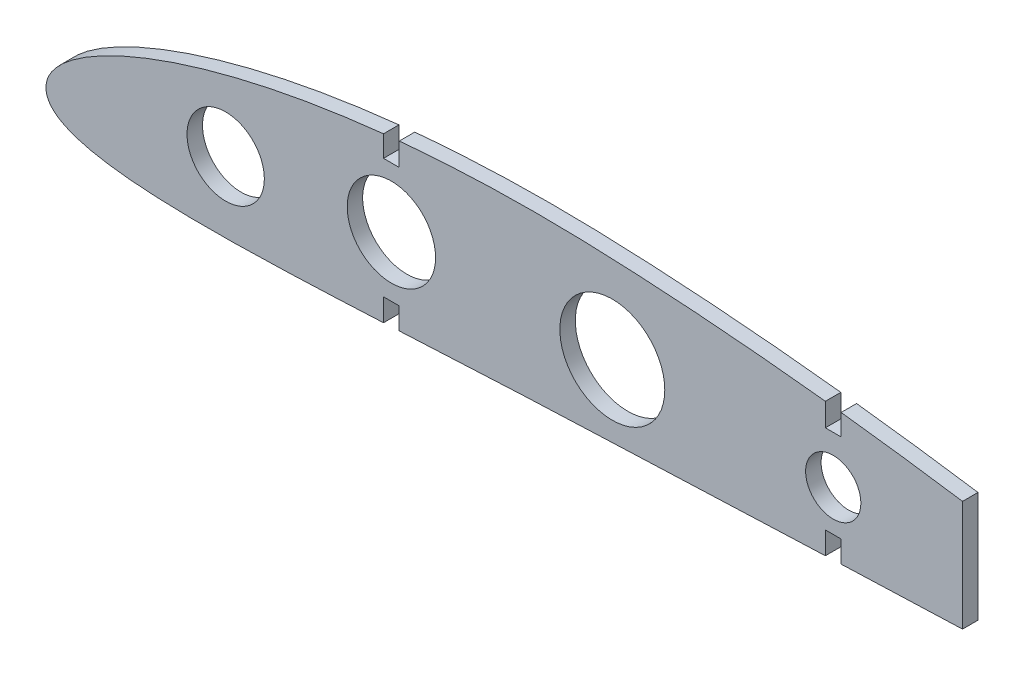
from build123d import *

# Parameters (mm, degrees)
SKETCH_1_R      = 7
SKETCH_1_R_2    = 8
SKETCH_1_R_3    = 9.5
SKETCH_1_R_4    = 5
EXTRUDE_1_DEPTH = 1.4


with BuildPart() as part:
    # Эскиз1 → Бобышка-Вытянуть1 (new, symmetric)
    with BuildSketch(Plane.XY):
        with BuildLine():
            Line((63.957619318, 19.450139662), (61.107619318, 19.450139662))
            Line((61.107619318, 19.450139662), (61.107619318, 23.303137173))
            add(Edge.make_bspline(
                [(61.107619318, 23.303137173), (59.917945614, 23.176751945), (56.739740439, 22.81448979), (51.605762688, 22.119065522), (45.744400311, 21.156564432), (39.995857594, 20.03537139), (34.397919842, 18.756316235), (29.010382103, 17.327615608), (23.925798408, 15.771864922), (19.27067884, 14.134269435), (15.179098391, 12.483335438), (11.74047579, 10.895610996), (8.959371869, 9.429577366), (6.76089118, 8.1086032), (5.033709748, 6.924638056), (3.671694933, 5.854229665), (2.592101123, 4.871305369), (1.738175668, 3.952595744), (1.06987083, 3.080946374), (0.57164541, 2.241622103), (0.215773899, 1.430785398), (0.102255581, 0.883241695), (0.047975, 0.621425001)],
                knots=[0.740090669, 0.740090669, 0.740090669, 0.740090669, 0.7539832, 0.77723469, 0.800246382, 0.822950709, 0.845237155, 0.866915896, 0.887662335, 0.906968281, 0.924203157, 0.938878975, 0.950931611, 0.960693484, 0.968646729, 0.975232933, 0.980794744, 0.985583761, 0.989781539, 0.993521313, 0.996902113, 1, 1, 1, 1], degree=3))
            add(Edge.make_bspline(
                [(0.047975, 0.621425001), (0.02271382, 0.373490086), (-0.027820789, -0.122499974), (0.077991212, -0.884434589), (0.34969565, -1.63883807), (0.814331135, -2.365068923), (1.46348078, -3.039275244), (2.290973016, -3.660999469), (3.30592875, -4.23577962), (4.535255619, -4.773674143), (6.029745688, -5.282192164), (7.868981215, -5.765316676), (10.168831391, -6.221716592), (13.075438188, -6.63961873), (16.728115362, -6.992956737), (21.189952096, -7.247345144), (26.399984415, -7.376638848), (32.197398564, -7.376256913), (38.397806759, -7.261436579), (44.857621768, -7.056641358), (51.486543096, -6.786453532), (56.920566709, -6.533358441), (60.139839208, -6.376114839), (61.107619318, -6.32836923)],
                knots=[0, 0, 0, 0, 0.002941446, 0.005884319, 0.00901613, 0.012364547, 0.016007934, 0.020036845, 0.024573728, 0.029783835, 0.03589701, 0.04324044, 0.052275965, 0.063634589, 0.077983176, 0.095698161, 0.116520086, 0.13966073, 0.16431217, 0.18991889, 0.216157201, 0.242837762, 0.254306514, 0.254306514, 0.254306514, 0.254306514], degree=3))
            Line((61.107619318, -6.32836923), (61.107619318, -2.257745247))
            Line((61.107619318, -2.257745247), (63.957619318, -2.257745247))
            Line((63.957619318, -2.257745247), (63.957619318, -6.186566126))
            add(Edge.make_bspline(
                [(63.957619318, -6.186566126), (64.317823095, -6.168514758), (66.969747676, -6.035316313), (71.910772709, -5.784005174), (78.771375576, -5.439680449), (85.610498609, -5.110951246), (92.432107589, -4.804953317), (99.25503119, -4.531981644), (106.097378404, -4.278274658), (112.96921168, -4.00308991), (119.864404254, -3.723176166), (126.773860473, -3.440067276), (133.855552455, -3.151608468), (138.633361552, -2.960411351), (141.107619318, -2.86287629)],
                knots=[0.265564796, 0.265564796, 0.265564796, 0.265564796, 0.269833583, 0.296993022, 0.324123272, 0.351139107, 0.378035509, 0.404946016, 0.431960837, 0.459078395, 0.4863474, 0.51364083, 0.540928595, 0.570237104, 0.570237104, 0.570237104, 0.570237104], degree=3))
            Line((141.107619318, -2.86287629), (141.107619318, 1.193130543))
            Line((141.107619318, 1.193130543), (143.957619318, 1.193130543))
            Line((143.957619318, 1.193130543), (143.957619318, -2.751209627))
            add(Edge.make_bspline(
                [(143.957619318, -2.751209627), (145.13020609, -2.705557458), (148.596084852, -2.571725453), (154.352602411, -2.355626415), (160.507662095, -2.135075484), (164.369425992, -2.00299999), (165.940456932, -1.950382964)],
                knots=[0.581490104, 0.581490104, 0.581490104, 0.581490104, 0.595379569, 0.622543445, 0.64967326, 0.668278692, 0.668278692, 0.668278692, 0.668278692], degree=3))
            Line((165.940456932, -1.950382964), (165.940456932, 7.49391084))
            Line((165.940456932, 7.49391084), (165.940456932, 18.08535451))
            add(Edge.make_bspline(
                [(165.940456932, 18.08535451), (165.930512987, 18.08685322), (163.740114226, 18.416932974), (159.368680729, 19.054501815), (152.821805128, 19.944885603), (147.683892721, 20.591912914), (144.728786809, 20.943344409), (143.957619318, 21.033629847)],
                knots=[0.332761263, 0.332761263, 0.332761263, 0.332761263, 0.332878042, 0.358484538, 0.384061186, 0.409602822, 0.418619192, 0.418619192, 0.418619192, 0.418619192], degree=3))
            Line((143.957619318, 21.033629847), (143.957619318, 17.19883932))
            Line((143.957619318, 17.19883932), (141.107619318, 17.19883932))
            Line((141.107619318, 17.19883932), (141.107619318, 21.360787161))
            add(Edge.make_bspline(
                [(141.107619318, 21.360787161), (140.647203073, 21.412583326), (138.008124909, 21.706530989), (133.19183673, 22.212004255), (126.658683026, 22.825721434), (120.136770918, 23.363973271), (113.62856714, 23.824677329), (107.152732037, 24.200242598), (100.741095693, 24.498399513), (94.411752715, 24.686649771), (88.155917993, 24.740095652), (81.949043055, 24.658849145), (75.780520591, 24.441013809), (69.785413798, 24.089605746), (65.850842722, 23.766532071), (63.957619318, 23.588464287)],
                knots=[0.429723551, 0.429723551, 0.429723551, 0.429723551, 0.435103874, 0.460559416, 0.485959195, 0.51130307, 0.536551515, 0.561723366, 0.586628867, 0.611085431, 0.6352512, 0.659272176, 0.683163753, 0.706922144, 0.729003809, 0.729003809, 0.729003809, 0.729003809], degree=3))
            Line((63.957619318, 23.588464287), (63.957619318, 19.450139662))
        make_face()
        with Locations((32.532619318, 5.448144701)):
            Circle(SKETCH_1_R, mode=Mode.SUBTRACT)
        with Locations((62.532619318, 8.596197208)):
            Circle(SKETCH_1_R_2, mode=Mode.SUBTRACT)
        with Locations((102.532619318, 8.596197208)):
            Circle(SKETCH_1_R_3, mode=Mode.SUBTRACT)
        with Locations((142.532619318, 8.596197208)):
            Circle(SKETCH_1_R_4, mode=Mode.SUBTRACT)
    extrude(amount=EXTRUDE_1_DEPTH, both=True)


solid = part.part
